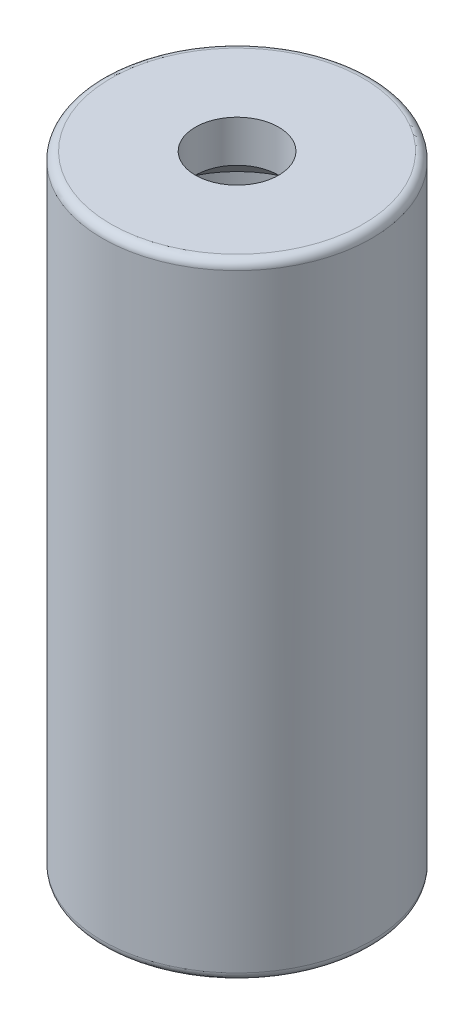
from build123d import *

# Parameters (mm, degrees)
SKETCH1_R           = 16.15
SKETCH1_R_2         = 11.15
BOSS_EXTRUDE1_DEPTH = 60
BOSS_EXTRUDE2_START = 5
SKETCH2_R           = 16.15
BOSS_EXTRUDE2_DEPTH = 5
FILLET1_R           = 1


with BuildPart() as part:
    # Sketch1 → Boss-Extrude1 (new body)
    with BuildSketch(Plane(origin=(0, 0, 0), x_dir=(1, 0, 0), z_dir=(0, 1, 0))):
        with Locations(Location((0, 0, 0), (0, 0, 270))):
            Circle(SKETCH1_R)
        with Locations(Location((0, 0, 0), (0, 0, 270))):
            Circle(SKETCH1_R_2, mode=Mode.SUBTRACT)
    extrude(amount=BOSS_EXTRUDE1_DEPTH)

    # Sketch2 → Boss-Extrude2 (add)
    with BuildSketch(Plane.XZ.offset(BOSS_EXTRUDE2_START)):
        with Locations(Location((0, 0, 0), (0, 0, 270))):
            Circle(SKETCH2_R)
    extrude(amount=-BOSS_EXTRUDE2_DEPTH)

    # Sketch3 → Revolve1 (revolve)
    with BuildSketch(Plane.XY, mode=Mode.PRIVATE) as revolve1_sk:
        Polygon((-11.15, 60), (-5, 65), (-5, 70), (-16.15, 70), (-16.15, 60), align=None)
    revolve(revolve1_sk.sketch.rotate(Axis((0, 60, 0), (0, -1, 0)), 270), axis=Axis((0, 60, 0), (0, -1, 0)))

    # Fillet1
    fillet1_edges = [part.edges().sort_by_distance(p)[0] for p in [
        (0, 70, -16.15),
        (0, -5, 16.15),
    ]]
    fillet(fillet1_edges, radius=FILLET1_R)


solid = part.part
